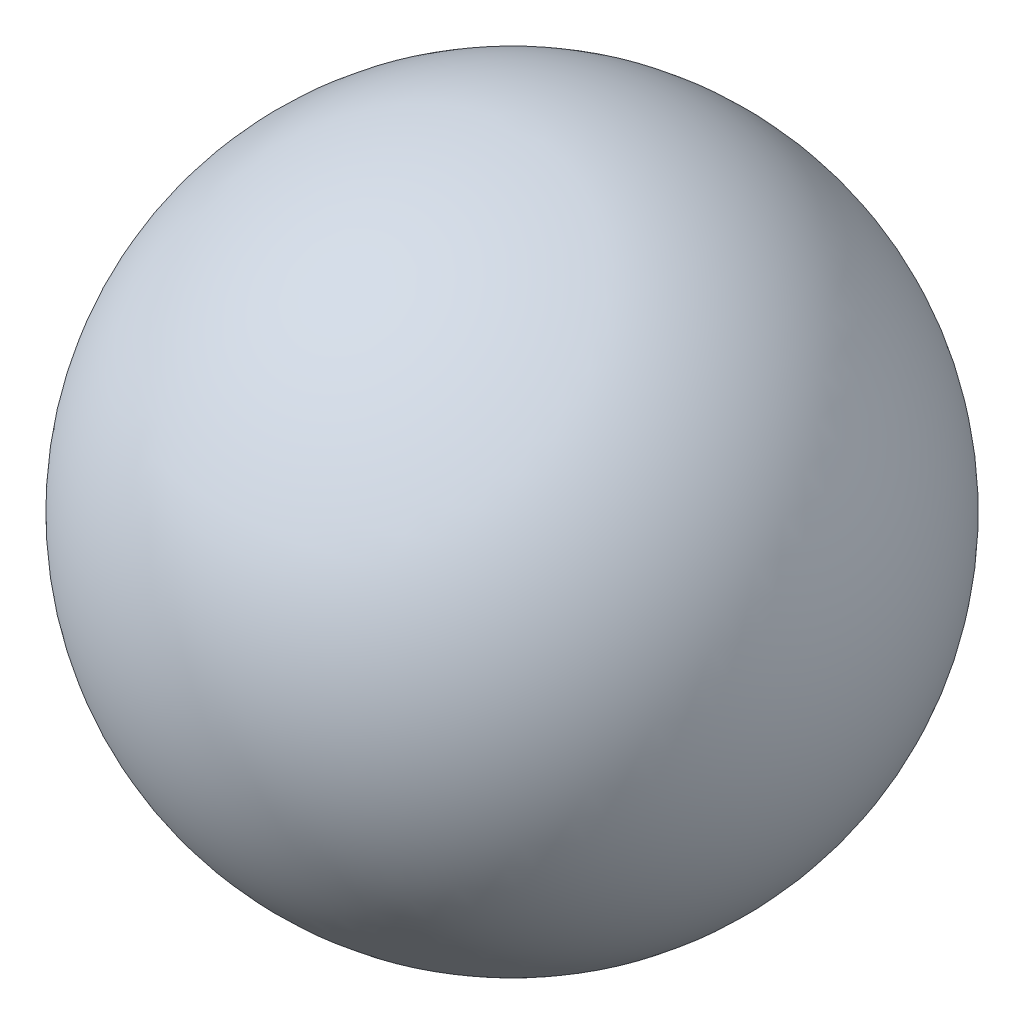
from build123d import *


with BuildPart() as part:
    # Sketch1 → Revolve1 (revolve)
    with BuildSketch(Plane.XY, mode=Mode.PRIVATE) as revolve1_sk:
        with BuildLine():
            Line((0, -31.75), (0, -29.68269698))
            Line((0, -29.68269698), (2, -29.68269698))
            ThreePointArc((2, -29.68269698), (29.75, 0), (2, 29.68269698))
            Line((2, 29.68269698), (0, 29.68269698))
            Line((0, 29.68269698), (0, 31.75))
            ThreePointArc((0, 31.75), (31.75, 0), (0, -31.75))
        make_face()
    revolve(revolve1_sk.sketch.rotate(Axis((0, 31.75, 0), (0, -1, 0)), 180), axis=Axis((0, 31.75, 0), (0, -1, 0)))


solid = part.part
